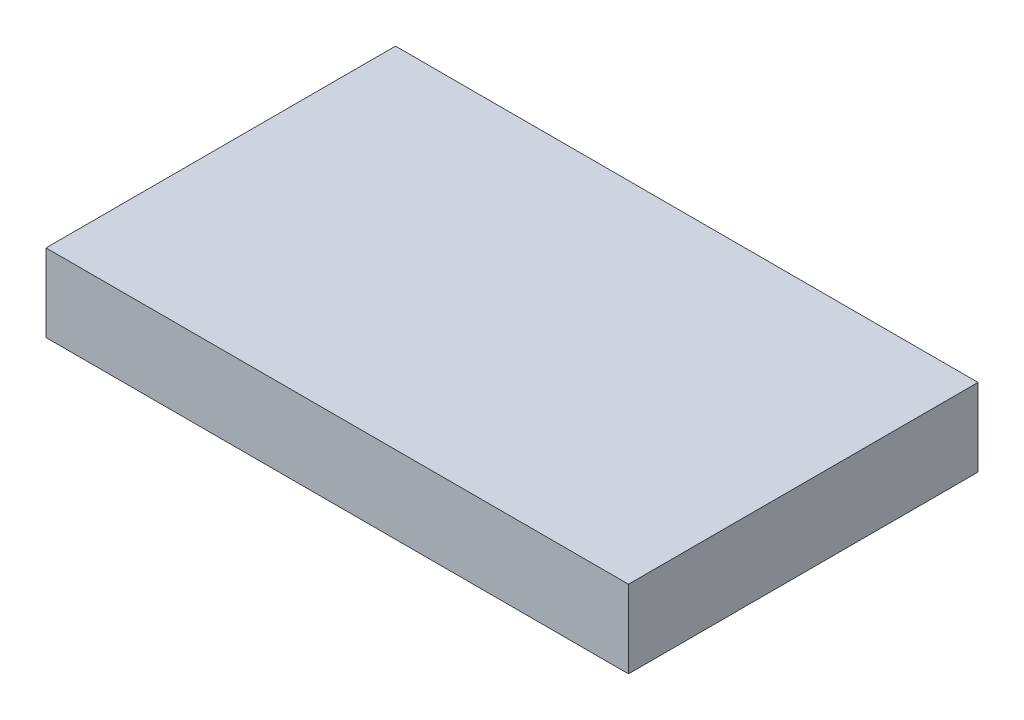
from build123d import *

# Parameters (mm, degrees)
CROQUIS1_W              = 150
CROQUIS1_H              = 20
SALIENTE_EXTRUIR2_DEPTH = 90


with BuildPart() as part:
    # Croquis1 → Saliente-Extruir2 (new body)
    with BuildSketch(Plane.XY):
        with Locations((-7.054735566, 5.082501159)):
            Rectangle(CROQUIS1_W, CROQUIS1_H)
    extrude(amount=SALIENTE_EXTRUIR2_DEPTH)


solid = part.part
